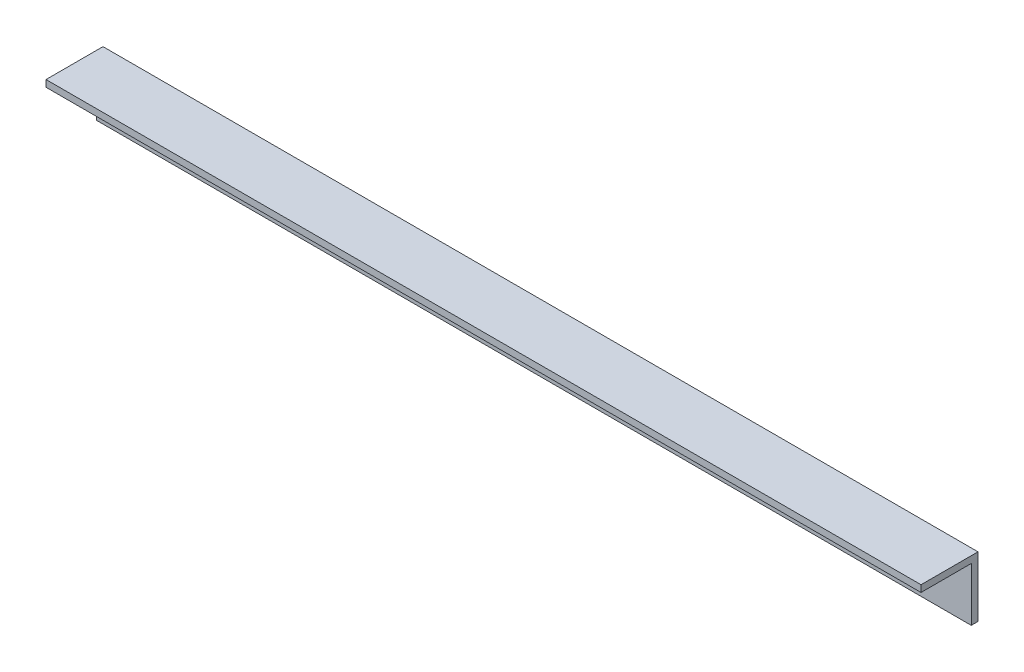
from build123d import *

# Parameters (mm, degrees)
CROQUIS1_W              = 390
CROQUIS1_H              = 50.8
SALIENTE_EXTRUIR1_DEPTH = 3
CROQUIS2_W              = 390
CROQUIS2_H              = 3
SALIENTE_EXTRUIR2_DEPTH = 47.8
CROQUIS3_W              = 3
CROQUIS3_H              = 23.9
CORTAR_EXTRUIR1_DEPTH   = 390
CORTAR_EXTRUIR2_REACH   = 205.296
CROQUIS4_W              = 390
CROQUIS4_H              = 25.4


with BuildPart() as part:
    # Croquis1 → Saliente-Extruir1 (new body)
    with BuildSketch(Plane.XY):
        Rectangle(CROQUIS1_W, CROQUIS1_H)
    extrude(amount=SALIENTE_EXTRUIR1_DEPTH)

    # Croquis2 → Saliente-Extruir2 (add)
    with BuildSketch(Plane.XY.offset(3)):
        Rectangle(CROQUIS2_W, CROQUIS2_H)
    extrude(amount=SALIENTE_EXTRUIR2_DEPTH)

    # Croquis3 → Cortar-Extruir1 (cut)
    with BuildSketch(Plane.ZY.offset(195)):
        with Locations((1.5, 13.45)):
            Rectangle(CROQUIS3_W, CROQUIS3_H)
    extrude(amount=-CORTAR_EXTRUIR1_DEPTH, mode=Mode.SUBTRACT)

    # Croquis4 → Cortar-Extruir2 (cut, up to next)
    with BuildSketch(Plane(origin=(0, 1.5, 0), x_dir=(1, 0, 0), z_dir=(0, 1, 0)), mode=Mode.PRIVATE) as cortar_extruir2_sk1:
        with Locations((0, -38.1)):
            Rectangle(CROQUIS4_W, CROQUIS4_H)
    cortar_extruir2_tool1 = extrude(cortar_extruir2_sk1.sketch, amount=-CORTAR_EXTRUIR2_REACH, mode=Mode.PRIVATE) & part.part
    add(cortar_extruir2_tool1.solids().sort_by_distance((0, 1.5, 38.1))[0], mode=Mode.SUBTRACT)


solid = part.part
